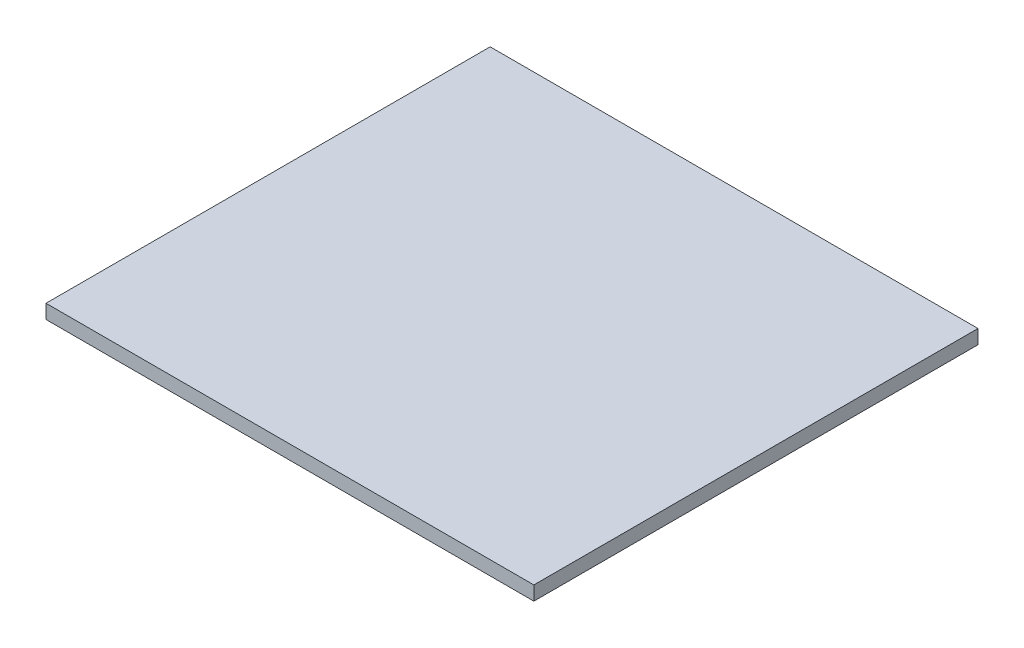
from build123d import *

# Parameters (mm, degrees)
SKETCH_1_W      = 346
SKETCH_1_H      = 315
EXTRUDE_1_DEPTH = 10


with BuildPart() as part:
    # 草图1 → 凸台-拉伸1 (new body)
    with BuildSketch(Plane(origin=(0, 0, 0), x_dir=(1, 0, 0), z_dir=(0, 1, 0))):
        with Locations((173, 157.5)):
            Rectangle(SKETCH_1_W, SKETCH_1_H)
    extrude(amount=EXTRUDE_1_DEPTH)


solid = part.part
